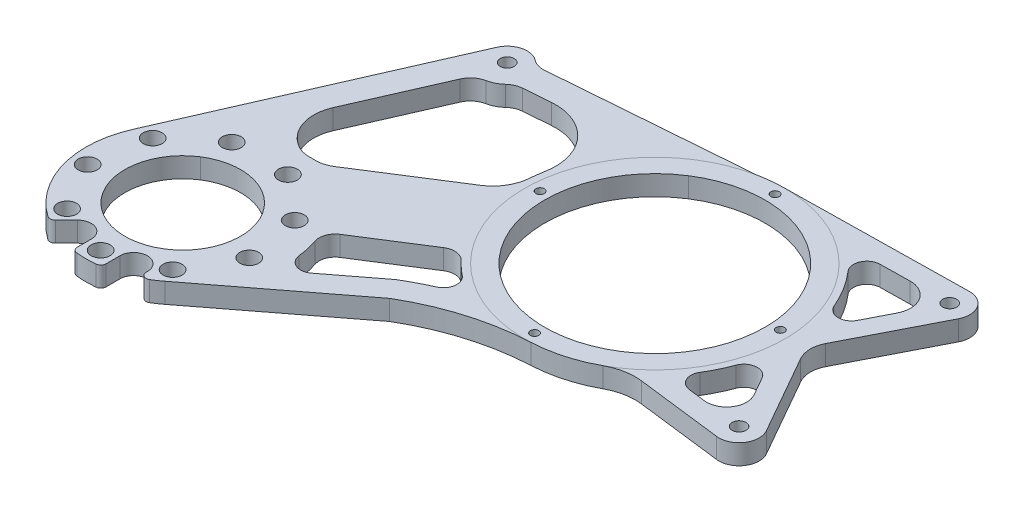
from build123d import *

# Parameters (mm, degrees)
SKETCH1_R                      = 27.4955
SKETCH1_R_2                    = 2
SKETCH1_R_3                    = 52.3875
SKETCH1_R_4                    = 3.3
BOSS_EXTRUDE1_DEPTH            = 9.525
M8_CLEARANCE_HOLE1_D           = 9
M8_CLEARANCE_HOLE1_CSINK_D     = 9.05
M8_CLEARANCE_HOLE1_CSINK_ANGLE = 90
CIRPATTERN1_COUNT              = 9
CUT_EXTRUDE2_DEPTH             = 703.782820758


with BuildPart() as part:
    # Sketch1 → Boss-Extrude1 (new body)
    with BuildSketch(Plane(origin=(0, 0, 0), x_dir=(-1, 0, 0), z_dir=(0, 1, 0))):
        with BuildLine():
            Line((-661.518109544, 9.526211138), (-574.322712035, 10.916849768))
            ThreePointArc((-574.322712035, 10.916849768), (-568.60639118, 11.272965732), (-562.947438024, 12.155797473))
            Line((-562.947438024, 12.155797473), (-468.549735034, 19.531113755))
            ThreePointArc((-468.549735034, 19.531113755), (-466.095677504, 19.039729903), (-463.807399751, 18.026003423))
            ThreePointArc((-463.807399751, 18.026003423), (-455.436670398, 15.825036693), (-448.740207572, 21.308717033))
            Line((-448.740207572, 21.308717033), (-396.041564291, 141.567674451))
            ThreePointArc((-396.041564291, 141.567674451), (-393.869824608, 172.384252636), (-411.692336104, 197.617881552))
            ThreePointArc((-411.692336104, 197.617881552), (-413.372500119, 198.071242365), (-414.950136715, 197.336701751))
            Line((-414.950136715, 197.336701751), (-420.215020333, 192.071818133))
            ThreePointArc((-420.215020333, 192.071818133), (-427.298656721, 190.662795249), (-431.31121441, 196.668012211))
            Line((-431.31121441, 196.668012211), (-431.31121441, 203.240745001))
            ThreePointArc((-431.31121441, 203.240745001), (-431.968379704, 204.945600851), (-433.59982344, 205.768273949))
            ThreePointArc((-433.59982344, 205.768273949), (-438.15, 205.994), (-442.70017656, 205.768273949))
            ThreePointArc((-442.70017656, 205.768273949), (-444.331620296, 204.945600851), (-444.98878559, 203.240745001))
            Line((-444.98878559, 203.240745001), (-444.98878559, 196.668012211))
            ThreePointArc((-444.98878559, 196.668012211), (-451.48878559, 190.168012211), (-457.98878559, 196.668012211))
            Line((-457.98878559, 196.668012211), (-457.98878559, 197.245022653))
            ThreePointArc((-457.98878559, 197.245022653), (-459.278285753, 199.455870942), (-461.837486501, 199.421924563))
            ThreePointArc((-461.837486501, 199.421924563), (-464.019895008, 198.024699819), (-466.120112298, 196.506730383))
            Line((-466.120112298, 196.506730383), (-526.629683433, 150.121113421))
            ThreePointArc((-526.629683433, 150.121113421), (-551.530592574, 139.247052869), (-578.312485484, 134.661130809))
            ThreePointArc((-578.312485484, 134.661130809), (-592.081443241, 132.419097692), (-604.99890828, 127.151270133))
            ThreePointArc((-604.99890828, 127.151270133), (-612.407574664, 124.492595217), (-620.274454537, 124.229743629))
            Line((-620.274454537, 124.229743629), (-661.161974504, 129.250099814))
            ThreePointArc((-661.161974504, 129.250099814), (-670.249252048, 125.077827159), (-670.600960367, 115.084690838))
            Line((-670.600960367, 115.084690838), (-649.049500747, 77.217685424))
            ThreePointArc((-649.049500747, 77.217685424), (-647.390214978, 71.218221534), (-648.781103624, 65.150913646))
            Line((-648.781103624, 65.150913646), (-670.149478209, 23.388671951))
            ThreePointArc((-670.149478209, 23.388671951), (-669.755736478, 14.01547017), (-661.518109544, 9.526211138))
        make_face()
        with Locations((-438.15, 160.02)):
            Circle(SKETCH1_R, mode=Mode.SUBTRACT)
        with Locations((-632.402453753, 70.257452317)):
            Circle(SKETCH1_R_2, mode=Mode.SUBTRACT)
        with Locations((-575.31, 72.821477372)):
            Circle(SKETCH1_R_3, mode=Mode.SUBTRACT)
        with Locations((-662.32278, 119.79609772)):
            Circle(SKETCH1_R_4, mode=Mode.SUBTRACT)
        with Locations((-661.67, 19.05)):
            Circle(SKETCH1_R_4, mode=Mode.SUBTRACT)
        with Locations((-457.464330992, 25.131712658)):
            Circle(SKETCH1_R_4, mode=Mode.SUBTRACT)
        with BuildLine():
            ThreePointArc((-518.217546247, 72.257452317), (-520.217546247, 70.257452317), (-518.217546247, 68.257452317))
            ThreePointArc((-518.217546247, 68.257452317), (-516.217546247, 70.257452317), (-518.217546247, 72.257452317))
        make_face(mode=Mode.SUBTRACT)
        with BuildLine():
            ThreePointArc((-575.31, 17.671477372), (-577.31, 15.671477372), (-575.31, 13.671477372))
            ThreePointArc((-575.31, 13.671477372), (-573.31, 15.671477372), (-575.31, 17.671477372))
        make_face(mode=Mode.SUBTRACT)
        with BuildLine():
            ThreePointArc((-575.31, 131.971477372), (-577.31, 129.971477372), (-575.31, 127.971477372))
            ThreePointArc((-575.31, 127.971477372), (-573.31, 129.971477372), (-575.31, 131.971477372))
        make_face(mode=Mode.SUBTRACT)
    extrude(amount=BOSS_EXTRUDE1_DEPTH)

    # M8 Clearance Hole1 (through all)
    with Locations(Plane(origin=(0, 0, 0), x_dir=(-1, 0, 0), z_dir=(0, -1, 0))):
        with Locations((-438.15, -199.019999978)):
            m8_clearance_hole1 = CounterSinkHole(M8_CLEARANCE_HOLE1_D / 2, M8_CLEARANCE_HOLE1_CSINK_D / 2, counter_sink_angle=M8_CLEARANCE_HOLE1_CSINK_ANGLE)

    # CirPattern1: M8 Clearance Hole1 ×9 about axis
    cirpattern1_axis = Axis((438.15, 9.525, 160.02), (0, -1, 0))
    for i in range(1, CIRPATTERN1_COUNT):
        add(m8_clearance_hole1.rotate(cirpattern1_axis, i * 360 / CIRPATTERN1_COUNT), mode=Mode.SUBTRACT)

    # Sketch10 → Cut-Extrude2 (cut, through all)
    with BuildSketch(Plane.XZ):
        with BuildLine():
            Line((501.653528527, 82.025066826), (459.226572507, 108.99771107))
            ThreePointArc((459.226572507, 108.99771107), (455.961057678, 110.474509108), (452.412988142, 110.980198854))
            Line((452.412988142, 110.980198854), (449.124699442, 110.980198854))
            ThreePointArc((449.124699442, 110.980198854), (446.028863873, 110.597089782), (443.119806681, 109.470876354))
            ThreePointArc((443.119806681, 109.470876354), (434.121445197, 98.905571071), (434.678898983, 85.038868854))
            Line((434.678898983, 85.038868854), (453.051892844, 43.11146904))
            ThreePointArc((453.051892844, 43.11146904), (455.812610468, 39.507256825), (459.928151148, 37.590428091))
            ThreePointArc((459.928151148, 37.590428091), (463.199383075, 36.463048748), (466.044923926, 34.494587478))
            ThreePointArc((466.044923926, 34.494587478), (468.684485829, 32.780789222), (471.738439028, 32.02068307))
            Line((471.738439028, 32.02068307), (484.33326163, 31.036646412))
            ThreePointArc((484.33326163, 31.036646412), (505.189412889, 39.365549463), (511.288065486, 60.979343851))
            ThreePointArc((511.288065486, 60.979343851), (510.771276342, 64.230937589), (510.419523322, 67.504498748))
            ThreePointArc((510.419523322, 67.504498748), (507.74174649, 75.794215969), (501.653528527, 82.025066826))
        make_face()
        with BuildLine():
            ThreePointArc((518.5458141, 116.433517192), (523.526027217, 115.31070897), (528.083819046, 117.610655627))
            ThreePointArc((528.083819046, 117.610655627), (531.194244853, 120.677331811), (534.503353276, 123.528481221))
            ThreePointArc((534.503353276, 123.528481221), (536.820485804, 129.284400418), (533.124064721, 134.267991506))
            ThreePointArc((533.124064721, 134.267991506), (526.661398117, 137.399578344), (520.391516426, 140.901217866))
            Line((520.391516426, 140.901217866), (497.676544793, 158.314132116))
            ThreePointArc((497.676544793, 158.314132116), (491.351665893, 159.127989595), (487.50938857, 154.038455032))
            ThreePointArc((487.50938857, 154.038455032), (486.663269024, 149.130057447), (485.330309415, 144.330942547))
            ThreePointArc((485.330309415, 144.330942547), (485.381225421, 139.4135911), (488.447021855, 135.568616467))
            Line((488.447021855, 135.568616467), (518.5458141, 116.433517192))
        make_face()
        with BuildLine():
            ThreePointArc((624.404021839, 30.087887821), (623.393763709, 23.333521757), (629.092422202, 19.569564558))
            Line((629.092422202, 19.569564558), (643.174006589, 19.344983952))
            ThreePointArc((643.174006589, 19.344983952), (652.784571346, 24.582452823), (653.243936699, 35.517854901))
            Line((653.243936699, 35.517854901), (646.828908384, 48.055353336))
            ThreePointArc((646.828908384, 48.055353336), (640.936661153, 51.508396194), (635.321174208, 47.621445103))
            ThreePointArc((635.321174208, 47.621445103), (630.562532601, 38.41885687), (624.404021839, 30.087887821))
        make_face()
        with BuildLine():
            ThreePointArc((630.78232235, 106.868564021), (633.867295103, 101.236717058), (636.38230144, 95.328290853))
            ThreePointArc((636.38230144, 95.328290853), (641.819407992, 91.195500663), (647.859361663, 94.383139612))
            Line((647.859361663, 94.383139612), (652.945866946, 103.320386857))
            ThreePointArc((652.945866946, 103.320386857), (652.594158627, 113.313523178), (643.506881083, 117.485795833))
            Line((643.506881083, 117.485795833), (635.420385908, 116.492899074))
            ThreePointArc((635.420385908, 116.492899074), (630.473854175, 112.946950119), (630.78232235, 106.868564021))
        make_face()
    extrude(amount=-CUT_EXTRUDE2_DEPTH, mode=Mode.SUBTRACT)


solid = part.part
